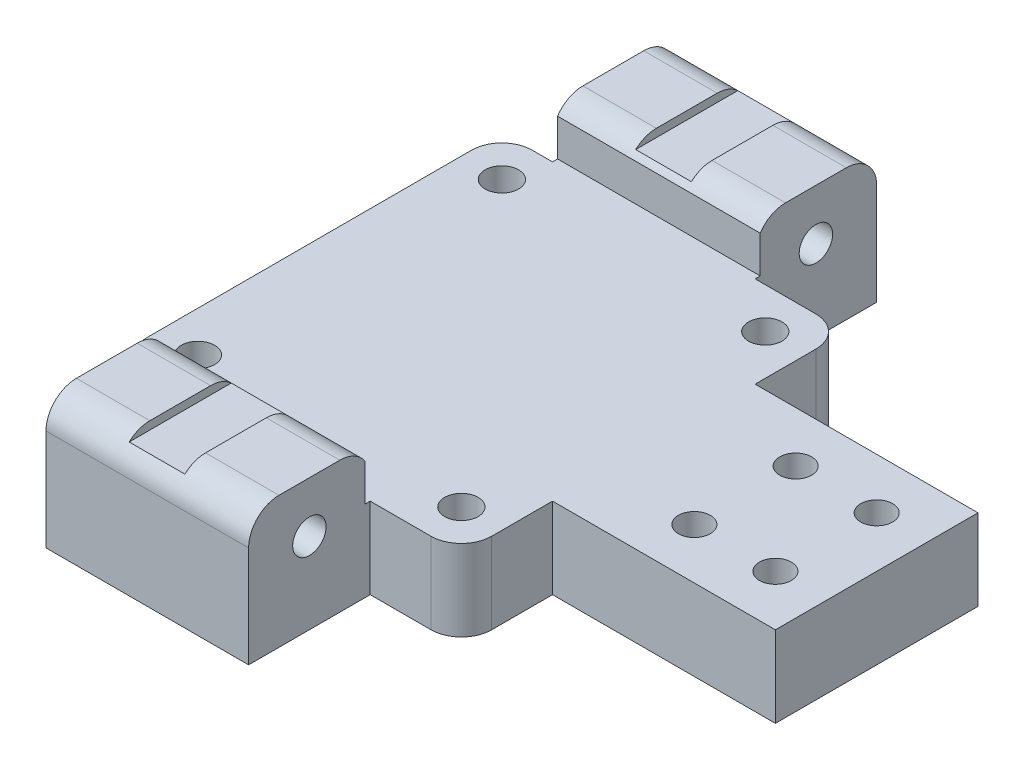
from build123d import *

# Parameters (mm, degrees)
SKETCH1_W            = 300
SKETCH1_H            = 20
BOSS_EXTRUDE1_DEPTH  = 8
SKETCH2_W            = 34
SKETCH2_H            = 8
BOSS_EXTRUDE2_DEPTH  = 9
SKETCH3_W            = 34
SKETCH3_H            = 8
BOSS_EXTRUDE3_DEPTH  = 9
SKETCH4_R            = 1.65
CUT_EXTRUDE1_DEPTH   = 302.504560496
SKETCH5_W            = 25
SKETCH5_H            = 8
BOSS_EXTRUDE4_DEPTH  = 17
SKETCH6_W            = 25
SKETCH6_H            = 8
BOSS_EXTRUDE5_DEPTH  = 17
SKETCH7_W            = 10
SKETCH7_H            = 38
CUT_EXTRUDE2_DEPTH   = 303.37890138
SKETCH8_W            = 7
SKETCH8_H            = 16
CUT_EXTRUDE3_DEPTH   = 4
CUT_EXTRUDE4_DEPTH   = 7
BOSS_EXTRUDE6_DEPTH  = 10
SKETCH12_W           = 8
SKETCH12_H           = 8
BOSS_EXTRUDE7_DEPTH  = 17
SKETCH13_R           = 1.7
CUT_EXTRUDE6_DEPTH   = 305.926220585
SKETCH14_W           = 20
SKETCH14_H           = 13
BOSS_EXTRUDE8_DEPTH  = 12
SKETCH15_R           = 1.6
CUT_EXTRUDE7_DEPTH   = 20
SKETCH16_W           = 20
SKETCH16_H           = 13
BOSS_EXTRUDE9_DEPTH  = 12
SKETCH17_R           = 1.6
CUT_EXTRUDE8_DEPTH   = 20
SKETCH18_W           = 20
SKETCH18_H           = 13
BOSS_EXTRUDE10_DEPTH = 12
SKETCH19_R           = 1.65
CUT_EXTRUDE9_DEPTH   = 20
SKETCH20_W           = 20
SKETCH20_H           = 13
BOSS_EXTRUDE11_DEPTH = 12
SKETCH21_R           = 1.65
CUT_EXTRUDE10_DEPTH  = 20
FILLET6_R            = 3
SKETCH22_W           = 123.750788161
SKETCH22_H           = 72.639217631
CUT_EXTRUDE11_DEPTH  = 244
SKETCH23_R           = 1.575
CUT_EXTRUDE12_DEPTH  = 71.611613776
FILLET7_R            = 3
SKETCH24_W           = 5.5
SKETCH24_H           = 78.243551934
CUT_EXTRUDE13_DEPTH  = 0.8
SKETCH25_W           = 20
SKETCH25_H           = 5.75655834
CUT_EXTRUDE14_DEPTH  = 0.5
SKETCH26_W           = 20
SKETCH26_H           = 21.459079842
CUT_EXTRUDE15_DEPTH  = 0.5


with BuildPart() as part:
    # Sketch1 → Boss-Extrude1 (new body)
    with BuildSketch(Plane(origin=(0, 0, 0), x_dir=(1, 0, 0), z_dir=(0, 1, 0))):
        with Locations((150, -10)):
            Rectangle(SKETCH1_W, SKETCH1_H)
    extrude(amount=BOSS_EXTRUDE1_DEPTH)

    # Sketch2 → Boss-Extrude2 (add)
    with BuildSketch(Plane.XY.offset(20)):
        with Locations((17, 4)):
            Rectangle(SKETCH2_W, SKETCH2_H)
        with Locations((283, 4)):
            Rectangle(SKETCH2_W, SKETCH2_H)
    extrude(amount=BOSS_EXTRUDE2_DEPTH)

    # Sketch3 → Boss-Extrude3 (add)
    with BuildSketch(Plane(origin=(0, 0, 0), x_dir=(-1, 0, 0), z_dir=(0, 0, -1))):
        with Locations((-17, 4)):
            Rectangle(SKETCH3_W, SKETCH3_H)
        with Locations((-283, 4)):
            Rectangle(SKETCH3_W, SKETCH3_H)
    extrude(amount=BOSS_EXTRUDE3_DEPTH)

    # Sketch4 → Cut-Extrude1 (cut, through all)
    with BuildSketch(Plane(origin=(0, 8, 0), x_dir=(1, 0, 0), z_dir=(0, 1, 0))):
        with Locations(Location((4, 5, 0), (0, 0, 270))):
            Circle(SKETCH4_R)
        with Locations(Location((30, 5, 0), (0, 0, 270))):
            Circle(SKETCH4_R)
        with Locations(Location((30, -25, 0), (0, 0, 270))):
            Circle(SKETCH4_R)
        with Locations(Location((4, -25, 0), (0, 0, 270))):
            Circle(SKETCH4_R)
        with Locations(Location((296, -25, 0), (0, 0, 270))):
            Circle(SKETCH4_R)
        with Locations(Location((296, 5, 0), (0, 0, 270))):
            Circle(SKETCH4_R)
        with Locations(Location((270, -25, 0), (0, 0, 270))):
            Circle(SKETCH4_R)
        with Locations(Location((270, 5, 0), (0, 0, 270))):
            Circle(SKETCH4_R)
    extrude(amount=-CUT_EXTRUDE1_DEPTH, mode=Mode.SUBTRACT)

    # Sketch5 → Boss-Extrude4 (add)
    with BuildSketch(Plane.XY.offset(20)):
        with Locations((253.5, 4)):
            Rectangle(SKETCH5_W, SKETCH5_H)
    extrude(amount=BOSS_EXTRUDE4_DEPTH)

    # Sketch6 → Boss-Extrude5 (add)
    with BuildSketch(Plane(origin=(0, 0, 0), x_dir=(-1, 0, 0), z_dir=(0, 0, -1))):
        with Locations((-253.5, 4)):
            Rectangle(SKETCH6_W, SKETCH6_H)
    extrude(amount=BOSS_EXTRUDE5_DEPTH)

    # Sketch7 → Cut-Extrude2 (cut, through all)
    with BuildSketch(Plane(origin=(0, 8, 0), x_dir=(1, 0, 0), z_dir=(0, 1, 0))):
        with Locations((254, -10)):
            Rectangle(SKETCH7_W, SKETCH7_H)
    extrude(amount=-CUT_EXTRUDE2_DEPTH, mode=Mode.SUBTRACT)

    # Sketch8 → Cut-Extrude3 (cut)
    with BuildSketch(Plane(origin=(0, 8, 0), x_dir=(1, 0, 0), z_dir=(0, 1, 0))):
        with Locations((262.5, -10)):
            Rectangle(SKETCH8_W, SKETCH8_H)
    extrude(amount=-CUT_EXTRUDE3_DEPTH, mode=Mode.SUBTRACT)

    # Sketch9 → Cut-Extrude4 (cut)
    with BuildSketch(Plane.ZY.offset(-259)):
        Polygon((18, 4), (22, 8), (18, 8), align=None)
        Polygon((2, 4), (-2, 8), (2, 8), align=None)
    extrude(amount=-CUT_EXTRUDE4_DEPTH, mode=Mode.SUBTRACT)

    # Sketch10 → Boss-Extrude6 (add)
    with BuildSketch(Plane.ZY.offset(-259)):
        Polygon((-2, 0), (-9, 8), (-9, 0), align=None)
        Polygon((29, 8), (22, 0), (29, 0), align=None)
    extrude(amount=BOSS_EXTRUDE6_DEPTH)

    # Sketch12 → Boss-Extrude7 (add)
    with BuildSketch(Plane.XY.offset(37)):
        with Locations((245, 4)):
            Rectangle(SKETCH12_W, SKETCH12_H)
    extrude(amount=BOSS_EXTRUDE7_DEPTH)

    # Sketch13 → Cut-Extrude6 (cut, through all)
    with BuildSketch(Plane(origin=(0, 8, 0), x_dir=(1, 0, 0), z_dir=(0, 1, 0))):
        with Locations(Location((245, -50, 0), (0, 0, 270))):
            Circle(SKETCH13_R)
        with Locations(Location((245, -18, 0), (0, 0, 270))):
            Circle(SKETCH13_R)
    extrude(amount=-CUT_EXTRUDE6_DEPTH, mode=Mode.SUBTRACT)

    # Sketch14 → Boss-Extrude8 (add)
    with BuildSketch(Plane.XY.offset(29)):
        with Locations((285, 6.5)):
            Rectangle(SKETCH14_W, SKETCH14_H)
    extrude(amount=BOSS_EXTRUDE8_DEPTH)

    # Sketch15 → Cut-Extrude7 (cut)
    with BuildSketch(Plane(origin=(295, 0, 0), x_dir=(0, 0, -1), z_dir=(1, 0, 0))):
        with Locations((-35, 8)):
            Circle(SKETCH15_R)
    extrude(amount=-CUT_EXTRUDE7_DEPTH, mode=Mode.SUBTRACT)

    # Sketch16 → Boss-Extrude9 (add)
    with BuildSketch(Plane(origin=(0, 0, -9), x_dir=(-1, 0, 0), z_dir=(0, 0, -1))):
        with Locations((-285, 6.5)):
            Rectangle(SKETCH16_W, SKETCH16_H)
    extrude(amount=BOSS_EXTRUDE9_DEPTH)

    # Sketch17 → Cut-Extrude8 (cut)
    with BuildSketch(Plane(origin=(295, 0, 0), x_dir=(0, 0, -1), z_dir=(1, 0, 0))):
        with Locations((15, 8)):
            Circle(SKETCH17_R)
    extrude(amount=-CUT_EXTRUDE8_DEPTH, mode=Mode.SUBTRACT)

    # Sketch18 → Boss-Extrude10 (add)
    with BuildSketch(Plane(origin=(0, 0, -9), x_dir=(-1, 0, 0), z_dir=(0, 0, -1))):
        with Locations((-15, 6.5)):
            Rectangle(SKETCH18_W, SKETCH18_H)
    extrude(amount=BOSS_EXTRUDE10_DEPTH)

    # Sketch19 → Cut-Extrude9 (cut)
    with BuildSketch(Plane.ZY.offset(-5)):
        with Locations((-15, 8)):
            Circle(SKETCH19_R)
    extrude(amount=-CUT_EXTRUDE9_DEPTH, mode=Mode.SUBTRACT)

    # Sketch20 → Boss-Extrude11 (add)
    with BuildSketch(Plane.XY.offset(29)):
        with Locations((15, 6.5)):
            Rectangle(SKETCH20_W, SKETCH20_H)
    extrude(amount=BOSS_EXTRUDE11_DEPTH)

    # Sketch21 → Cut-Extrude10 (cut)
    with BuildSketch(Plane.ZY.offset(-5)):
        with Locations((35, 8)):
            Circle(SKETCH21_R)
    extrude(amount=-CUT_EXTRUDE10_DEPTH, mode=Mode.SUBTRACT)

    # Fillet6
    fillet6_edges = [part.edges().sort_by_distance(p)[0] for p in [
        (285, 13, 29),
        (285, 13, 41),
        (285, 13, -9),
        (285, 13, -21),
        (15, 13, -9),
        (15, 13, -21),
        (15, 13, 29),
        (15, 13, 41),
    ]]
    fillet(fillet6_edges, radius=FILLET6_R)

    # Sketch22 → Cut-Extrude11 (cut)
    with BuildSketch(Plane(origin=(300, 0, 0), x_dir=(0, 0, -1), z_dir=(1, 0, 0))):
        with Locations((-10.128058827, -1.301866478)):
            Rectangle(SKETCH22_W, SKETCH22_H)
    extrude(amount=-CUT_EXTRUDE11_DEPTH, mode=Mode.SUBTRACT)

    # Sketch23 → Cut-Extrude12 (cut, through all)
    with BuildSketch(Plane(origin=(0, 0, 0), x_dir=(-1, 0, 0), z_dir=(0, -1, 0))):
        with Locations(Location((-51, -5, 0), (0, 0, 90))):
            Circle(SKETCH23_R)
        with Locations(Location((-51, -15, 0), (0, 0, 90))):
            Circle(SKETCH23_R)
        with Locations(Location((-43, -5, 0), (0, 0, 90))):
            Circle(SKETCH23_R)
        with Locations(Location((-43, -15, 0), (0, 0, 90))):
            Circle(SKETCH23_R)
    extrude(amount=-CUT_EXTRUDE12_DEPTH, mode=Mode.SUBTRACT)

    # Fillet7
    fillet7_edges = [part.edges().sort_by_distance(p)[0] for p in [
        (0, 4, 29),
        (34, 4, 29),
        (0, 4, -9),
        (34, 4, -9),
    ]]
    fillet(fillet7_edges, radius=FILLET7_R)

    # Sketch24 → Cut-Extrude13 (cut)
    with BuildSketch(Plane(origin=(0, 13, 0), x_dir=(1, 0, 0), z_dir=(0, 1, 0))):
        with Locations((15, -9.577024089)):
            Rectangle(SKETCH24_W, SKETCH24_H)
    extrude(amount=-CUT_EXTRUDE13_DEPTH, mode=Mode.SUBTRACT)

    # Sketch25 → Cut-Extrude14 (cut)
    with BuildSketch(Plane(origin=(0, 0, 29), x_dir=(-1, 0, 0), z_dir=(0, 0, -1))):
        with Locations((-15, 10.87827917)):
            Rectangle(SKETCH25_W, SKETCH25_H)
    extrude(amount=-CUT_EXTRUDE14_DEPTH, mode=Mode.SUBTRACT)

    # Sketch26 → Cut-Extrude15 (cut)
    with BuildSketch(Plane.XY.offset(-9)):
        with Locations((15, 18.729539921)):
            Rectangle(SKETCH26_W, SKETCH26_H)
    extrude(amount=-CUT_EXTRUDE15_DEPTH, mode=Mode.SUBTRACT)


solid = part.part
